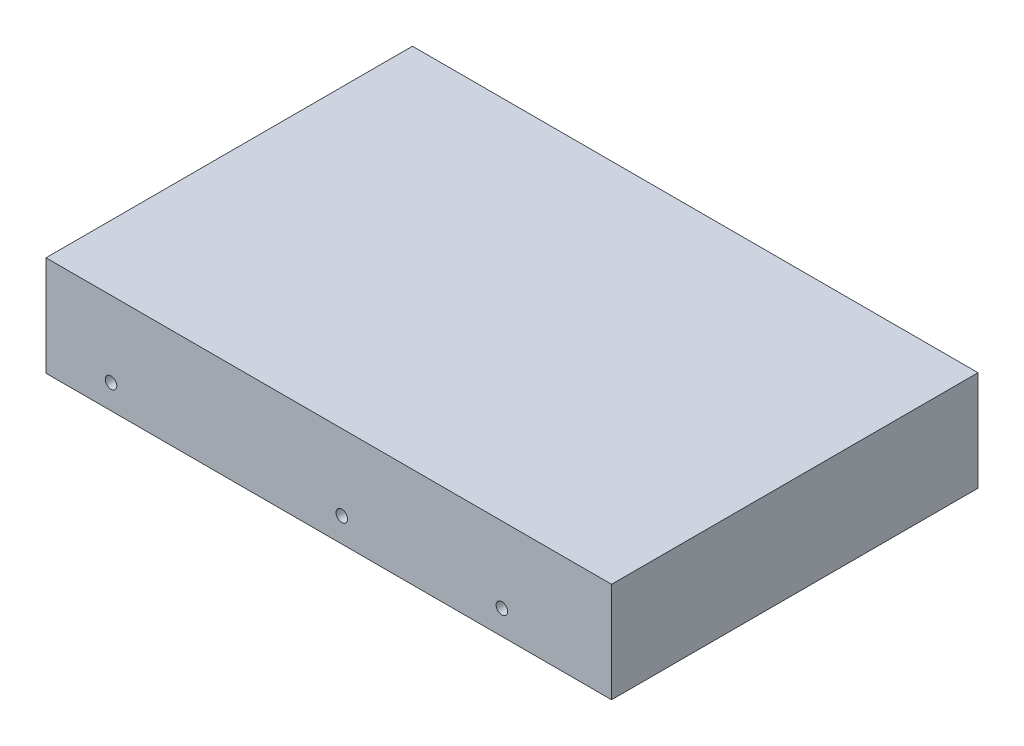
from build123d import *

# Parameters (mm, degrees)
SKETCH1_W           = 147
SKETCH1_H           = 95.25
BOSS_EXTRUDE1_DEPTH = 26
SKETCH2_R           = 1.5
CUT_EXTRUDE3_DEPTH  = 26


with BuildPart() as part:
    # Sketch1 → Boss-Extrude1 (new body)
    with BuildSketch(Plane(origin=(0, 0, 0), x_dir=(1, 0, 0), z_dir=(0, 1, 0))):
        with Locations((8.120065789, 8.250822368)):
            Rectangle(SKETCH1_W, SKETCH1_H)
    extrude(amount=BOSS_EXTRUDE1_DEPTH)

    # Sketch2 → Cut-Extrude3 (cut)
    with BuildSketch(Plane.XY.offset(39.374177632)):
        with Locations((-48.479934211, 6.35)):
            Circle(SKETCH2_R)
        with Locations((11.510065789, 6.35)):
            Circle(SKETCH2_R)
        with Locations((53.120065789, 6.35)):
            Circle(SKETCH2_R)
    extrude(amount=-CUT_EXTRUDE3_DEPTH, mode=Mode.SUBTRACT)


solid = part.part
